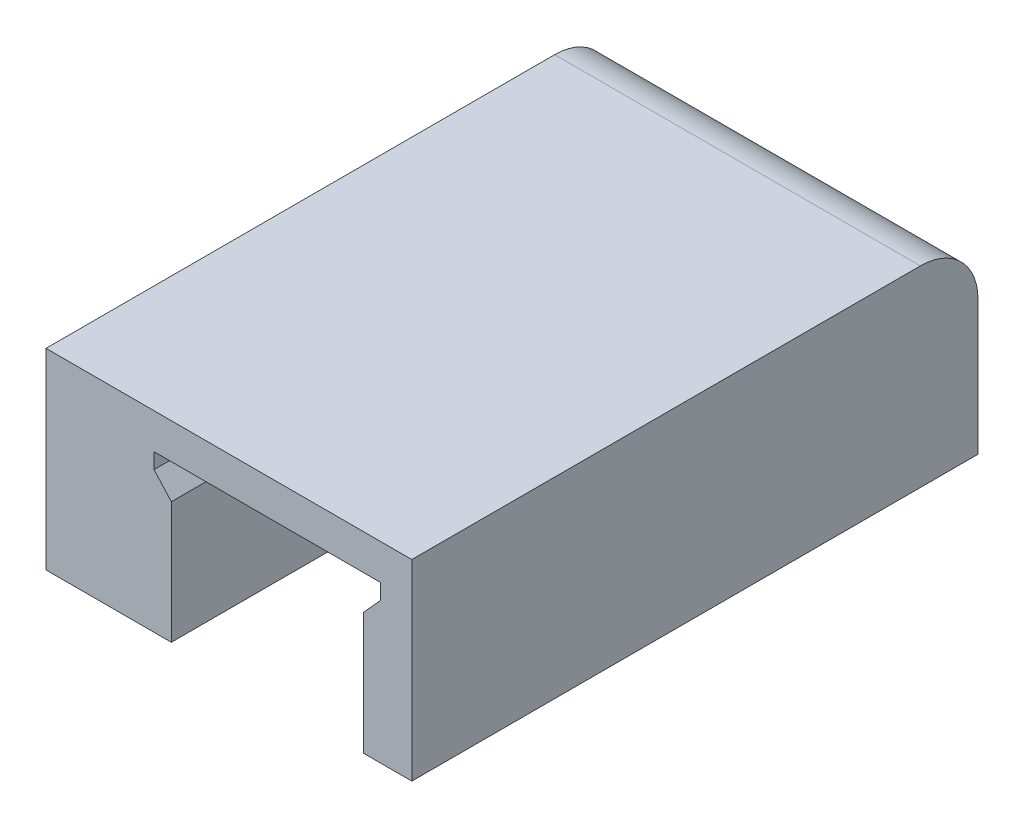
from build123d import *

# Parameters (mm, degrees)
SKETCH_1_W          = 29.5
SKETCH_1_H          = 10
EXTRUDE_1_DEPTH     = 13.06
FILLET_1_R          = 3
CUT_EXTRUDE_1_DEPTH = 25.35
EXTRUDE_START       = 1
EXTRUDE_2_DEPTH     = 1
EXTRUDE_START_2     = -13.06
EXTRUDE_3_DEPTH     = 5


with BuildPart() as part:
    # 草图1 → 凸台-拉伸1 (new body)
    with BuildSketch(Plane(origin=(0, 0, 0), x_dir=(0, 0, -1), z_dir=(1, 0, 0))):
        Rectangle(SKETCH_1_W, SKETCH_1_H)
    extrude(amount=EXTRUDE_1_DEPTH)

    # 圆角1
    fillet_1_edges = [part.edges().sort_by_distance(p)[0] for p in [
        (6.53, 5, -14.75),
    ]]
    fillet(fillet_1_edges, radius=FILLET_1_R)

    # 草图3 → 切除-拉伸1 (cut)
    with BuildSketch(Plane.XY.offset(14.75)):
        Polygon((11.53, -7.004935671), (1.53, -7.004935671), (1.53, 1.342439599), (0.63, 2.342439599), (0.63, 3.15), (12.43, 3.15), (12.43, 2.342439599), (11.53, 1.342439599), align=None)
    extrude(amount=-CUT_EXTRUDE_1_DEPTH, mode=Mode.SUBTRACT)

    # 草图4 → 凸台-拉伸2 (add)
    with BuildSketch(Plane(origin=(13.06, 0, 0), x_dir=(0, 0, -1), z_dir=(1, 0, 0)).offset(EXTRUDE_START)):
        with BuildLine():
            Line((14.75, -5), (14.75, 2))
            ThreePointArc((14.75, 2), (13.871320344, 4.121320344), (11.75, 5))
            Line((11.75, 5), (-14.75, 5))
            Line((-14.75, 5), (-14.75, -5))
            Line((-14.75, -5), (14.75, -5))
        make_face()
    extrude(amount=-EXTRUDE_2_DEPTH)

    # 草图4<3> → 凸台-拉伸3 (add)
    with BuildSketch(Plane(origin=(13.06, 0, 0), x_dir=(0, 0, -1), z_dir=(1, 0, 0)).offset(EXTRUDE_START_2)):
        with BuildLine():
            Line((14.75, -5), (14.75, 2))
            ThreePointArc((14.75, 2), (13.871320344, 4.121320344), (11.75, 5))
            Line((11.75, 5), (-14.75, 5))
            Line((-14.75, 5), (-14.75, -5))
            Line((-14.75, -5), (14.75, -5))
        make_face()
    extrude(amount=-EXTRUDE_3_DEPTH)


solid = part.part
